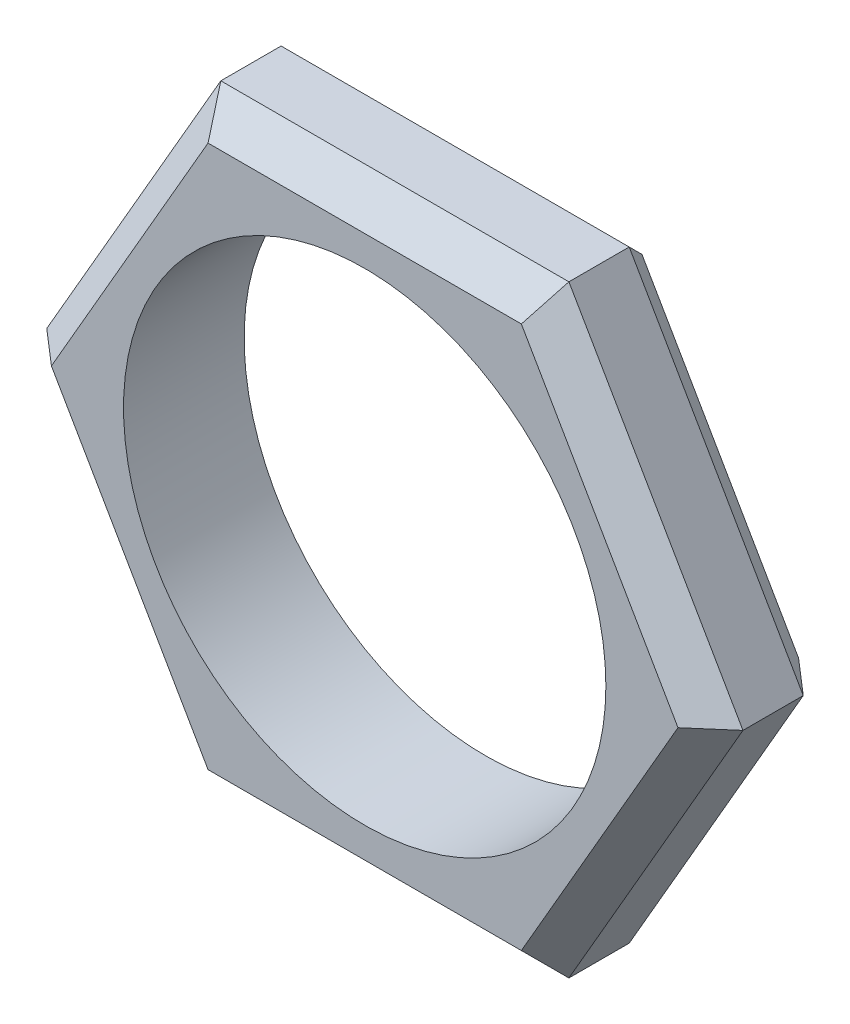
from build123d import *

# Parameters (mm, degrees)
SKETCH1_R           = 4
BOSS_EXTRUDE1_DEPTH = 2
CHAMFER1_SIZE       = 0.5


with BuildPart() as part:
    # Sketch1 → Boss-Extrude1 (new body)
    with BuildSketch(Plane.XY):
        Polygon((2.886751346, 5), (-2.886751346, 5), (-5.773502692, 0), (-2.886751346, -5), (2.886751346, -5), (5.773502692, 0), align=None)
        Circle(SKETCH1_R, mode=Mode.SUBTRACT)
    extrude(amount=BOSS_EXTRUDE1_DEPTH)

    # Chamfer1
    chamfer1_edges = [part.edges().sort_by_distance(p)[0] for p in [
        (-4.330127019, 2.5, 2),
        (-4.330127019, -2.5, 2),
        (0, -5, 2),
        (4.330127019, -2.5, 2),
        (4.330127019, 2.5, 2),
        (4.330127019, -2.5, 0),
        (0, -5, 0),
        (-4.330127019, -2.5, 0),
        (-4.330127019, 2.5, 0),
        (0, 5, 0),
        (4.330127019, 2.5, 0),
        (0, 5, 2),
    ]]
    chamfer(chamfer1_edges, length=CHAMFER1_SIZE)


solid = part.part
